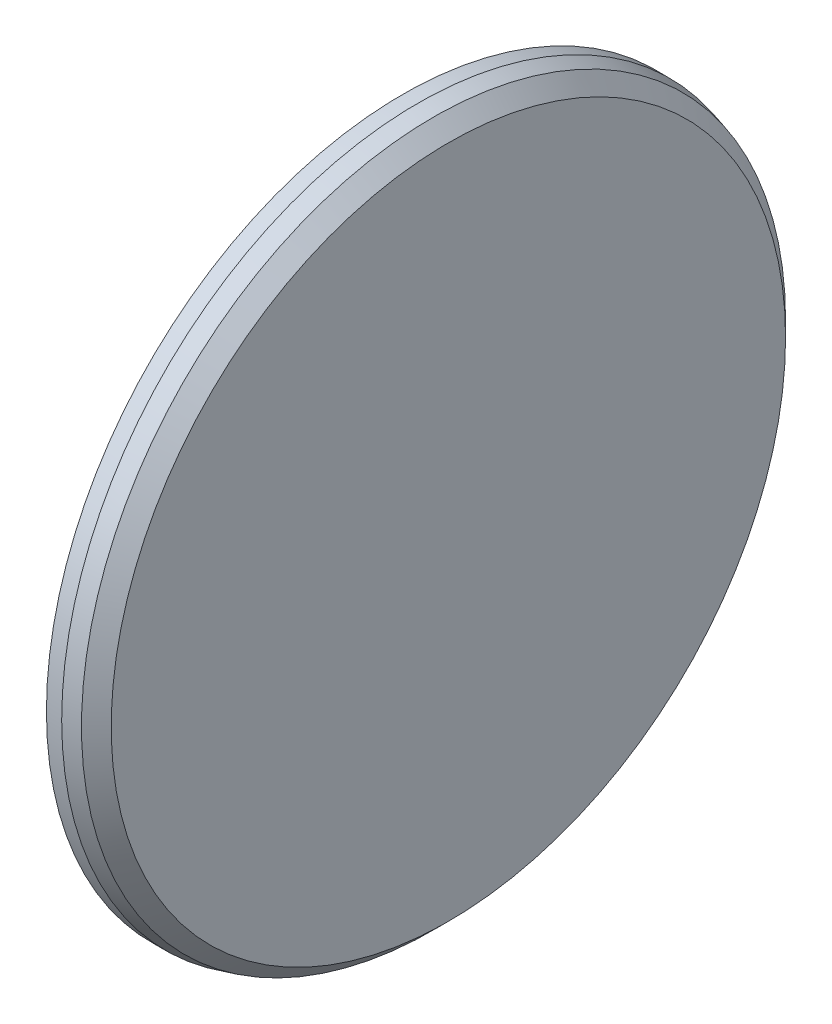
from build123d import *

# Parameters (mm, degrees)
BOSS_EXTRUDE2_DEPTH = 20


with BuildPart() as part:
    # Sketch1 → Revolve2 (revolve)
    with BuildSketch(Plane(origin=(0, 0, 0), x_dir=(1, 0, 0), z_dir=(0, 1, 0))):
        Polygon((-30, 8.788389936), (-30, -36.211610064), (0, -36.211610064), (0, -358.711610064), (-50, -358.711610064), (-50, -458.711610064), (30, -458.711610064), (30, -36.211610064), (30, -16.211610064), (10.490381057, 3.298008879), (-10, 8.788389936), align=None)
    revolve(axis=Axis((30, 0, 458.711610064), (-1, 0, 0)))

    # Sketch3 → Boss-Extrude2 (add)
    with BuildSketch(Plane.ZY):
        with BuildLine():
            ThreePointArc((365.470230754, 412.08287417), (416.16502941, 400.436970696), (438.711610064, 353.562229318))
            Line((438.711610064, 353.562229318), (438.711610064, 105.830052443))
            ThreePointArc((438.711610064, 105.830052443), (436.688850417, 99.799825551), (431.438882792, 96.209138584))
            ThreePointArc((431.438882792, 96.209138584), (458.711610064, 100), (485.984337337, 96.209138584))
            ThreePointArc((485.984337337, 96.209138584), (480.734369712, 99.799825551), (478.711610064, 105.830052443))
            Line((478.711610064, 105.830052443), (478.711610064, 411.407644557))
            ThreePointArc((478.711610064, 411.407644557), (481.902525224, 418.73132967), (489.438882792, 421.381163213))
            ThreePointArc((489.438882792, 421.381163213), (427.110693539, 421.316546168), (365.470230754, 412.08287417))
        make_face()
        with BuildLine():
            ThreePointArc((209.584762475, 328.012292163), (207.321571254, 335.673641176), (211.391475921, 342.547808703))
            ThreePointArc((211.391475921, 342.547808703), (163.68684793, 302.434521389), (122.402803894, 255.739392532))
            ThreePointArc((122.402803894, 255.739392532), (168.723115157, 279.404101342), (216.125300944, 257.988628872))
            Line((216.125300944, 257.988628872), (375.364474759, 68.214771395))
            ThreePointArc((375.364474759, 68.214771395), (377.691106101, 62.295144755), (375.977446668, 56.169904816))
            ThreePointArc((375.977446668, 56.169904816), (394.432849096, 76.604444312), (417.76168902, 91.231047163))
            ThreePointArc((417.76168902, 91.231047163), (411.431931402, 90.60705882), (406.006252484, 93.926275782))
            Line((406.006252484, 93.926275782), (209.584762475, 328.012292163))
        make_face()
        with BuildLine():
            ThreePointArc((753.108657258, 303.045588326), (705.320959195, 343.059876583), (652.166335256, 375.608199193))
            ThreePointArc((652.166335256, 375.608199193), (683.514961604, 334.1009311), (670.656141461, 283.700133259))
            Line((670.656141461, 283.700133259), (511.416967645, 93.926275782))
            ThreePointArc((511.416967645, 93.926275782), (505.991288727, 90.60705882), (499.661531109, 91.231047163))
            ThreePointArc((499.661531109, 91.231047163), (522.990371033, 76.604444312), (541.445773461, 56.169904816))
            ThreePointArc((541.445773461, 56.169904816), (539.732114028, 62.295144755), (542.058745369, 68.214771395))
            Line((542.058745369, 68.214771395), (738.480235378, 302.300787776))
            ThreePointArc((738.480235378, 302.300787776), (745.632192253, 305.859975332), (753.108657258, 303.045588326))
        make_face()
        with BuildLine():
            ThreePointArc((57.027135609, 91.136342816), (50.368810332, 95.550525378), (49.067908473, 103.432527506))
            ThreePointArc((49.067908473, 103.432527506), (38.308367359, 42.040022866), (36.698005098, -20.267393099))
            ThreePointArc((36.698005098, -20.267393099), (56.970040534, 27.634947739), (107.047821907, 41.699281753))
            Line((107.047821907, 41.699281753), (351.016390364, -1.318959311))
            ThreePointArc((351.016390364, -1.318959311), (356.603756032, -4.358126605), (359.228245085, -10.151851674))
            ThreePointArc((359.228245085, -10.151851674), (360.230834763, 17.364817767), (368.699963867, 43.564934854))
            ThreePointArc((368.699963867, 43.564934854), (364.252180193, 39.018242282), (357.962317471, 38.073350809))
            Line((357.962317471, 38.073350809), (57.027135609, 91.136342816))
        make_face()
        with BuildLine():
            ThreePointArc((879.026781484, 42.911614684), (868.139969636, 104.28167806), (848.34282383, 163.382273394))
            ThreePointArc((848.34282383, 163.382273394), (845.676907202, 111.435352724), (803.429471115, 81.091591873))
            Line((803.429471115, 81.091591873), (559.460902658, 38.073350809))
            ThreePointArc((559.460902658, 38.073350809), (553.171039936, 39.018242282), (548.723256262, 43.564934854))
            ThreePointArc((548.723256262, 43.564934854), (557.192385366, 17.364817767), (558.194975044, -10.151851674))
            ThreePointArc((558.194975044, -10.151851674), (560.819464096, -4.358126605), (566.406829765, -1.318959311))
            Line((566.406829765, -1.318959311), (867.342011626, 51.744032695))
            ThreePointArc((867.342011626, 51.744032695), (875.108530109, 49.873339281), (879.026781484, 42.911614684))
        make_face()
        with BuildLine():
            ThreePointArc((92.422138567, -188.383314203), (84.48418363, -189.28174317), (78.421181682, -184.079982836))
            ThreePointArc((78.421181682, -184.079982836), (109.641236311, -238.025469578), (148.458062224, -286.790840252))
            ThreePointArc((148.458062224, -286.790840252), (133.196311154, -237.064905039), (162.517737657, -194.101622734))
            Line((162.517737657, -194.101622734), (377.060096165, -70.235534297))
            ThreePointArc((377.060096165, -70.235534297), (383.293805668, -68.972182092), (389.028415611, -71.723443941))
            ThreePointArc((389.028415611, -71.723443941), (372.109069686, -50), (361.755688338, -24.485694643))
            ThreePointArc((361.755688338, -24.485694643), (361.27104602, -30.827643459), (357.060096165, -35.594518146))
            Line((357.060096165, -35.594518146), (92.422138567, -188.383314203))
        make_face()
        with BuildLine():
            ThreePointArc((808.274765719, -237.301180377), (839.382900343, -183.29107659), (862.206537215, -125.292033918))
            ThreePointArc((862.206537215, -125.292033918), (826.773489629, -163.372065657), (774.905482472, -159.460606583))
            Line((774.905482472, -159.460606583), (560.363123964, -35.594518146))
            ThreePointArc((560.363123964, -35.594518146), (556.152174109, -30.827643459), (555.667531791, -24.485694643))
            ThreePointArc((555.667531791, -24.485694643), (545.314150443, -50), (528.394804518, -71.723443941))
            ThreePointArc((528.394804518, -71.723443941), (534.129414461, -68.972182092), (540.363123964, -70.235534297))
            Line((540.363123964, -70.235534297), (805.001081562, -223.024330354))
            ThreePointArc((805.001081562, -223.024330354), (809.748121339, -229.4495865), (808.274765719, -237.301180377))
        make_face()
        with BuildLine():
            ThreePointArc((299.208056092, -379.756324859), (293.704728831, -385.546980456), (285.716572789, -385.459423387))
            ThreePointArc((285.716572789, -385.459423387), (344.308012628, -406.716199448), (405.389202469, -419.121665926))
            ThreePointArc((405.389202469, -419.121665926), (361.734807834, -390.839454066), (356.580058134, -339.080220745))
            Line((356.580058134, -339.080220745), (441.309452776, -106.288122204))
            ThreePointArc((441.309452776, -106.288122204), (445.272684156, -101.313387037), (451.434127263, -99.73483967))
            ThreePointArc((451.434127263, -99.73483967), (424.509595732, -93.969262079), (400.17816613, -81.079195489))
            ThreePointArc((400.17816613, -81.079195489), (403.883434695, -86.248932215), (403.721747944, -92.607316471))
            Line((403.721747944, -92.607316471), (299.208056092, -379.756324859))
        make_face()
        with BuildLine():
            ThreePointArc((573.958264463, -406.478115832), (632.505503639, -385.09989945), (687.27048984, -355.340806094))
            ThreePointArc((687.27048984, -355.340806094), (635.649828055, -361.73587884), (598.430866826, -325.399415012))
            Line((598.430866826, -325.399415012), (513.701472185, -92.607316471))
            ThreePointArc((513.701472185, -92.607316471), (513.539785434, -86.248932215), (517.245053999, -81.079195489))
            ThreePointArc((517.245053999, -81.079195489), (492.913624397, -93.969262079), (465.989092865, -99.73483967))
            ThreePointArc((465.989092865, -99.73483967), (472.150535973, -101.313387037), (476.113767353, -106.288122204))
            Line((476.113767353, -106.288122204), (580.627459205, -393.437130592))
            ThreePointArc((580.627459205, -393.437130592), (580.133827608, -401.41050071), (573.958264463, -406.478115832))
        make_face()
    extrude(amount=BOSS_EXTRUDE2_DEPTH)


solid = part.part
